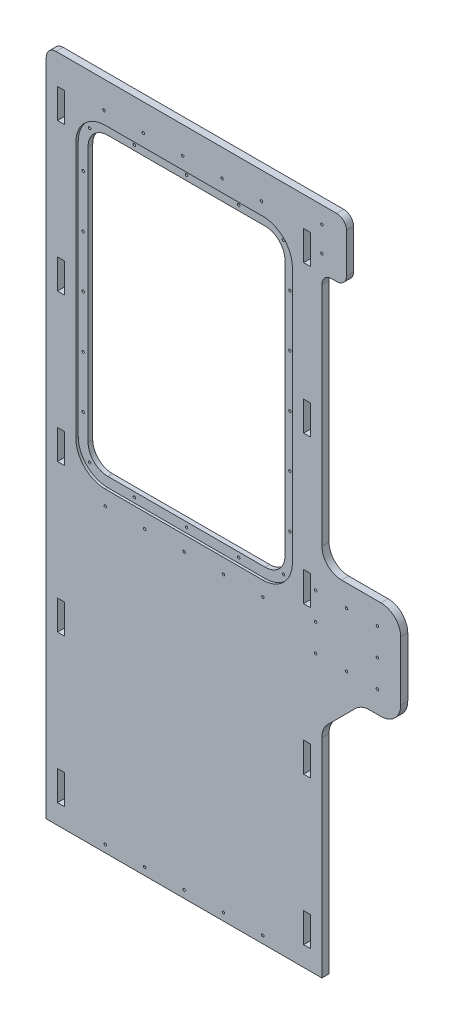
from build123d import *

# Parameters (mm, degrees)
BOSS_EXTRUDE1_DEPTH     = 18.288
SKETCH1_W               = 18.288
SKETCH1_H               = 76.2
MORTISE_CUTS_DEPTH      = 1955.524073472
LPATTERN1_COUNT         = 5
LPATTERN1_PITCH         = 381
WINDOW_RECESS_DEPTH     = 6.35
SKETCH3_R               = 3.175
CUT_EXTRUDE4_DEPTH      = 1955.474972641
SKETCH6_R               = 3.175
CUT_EXTRUDE5_DEPTH      = 1955.474972641
LPATTERN2_COUNT         = 3
LPATTERN2_PITCH         = 134.62
LPATTERN2_COL_COUNT     = 3
LPATTERN2_COL_PITCH     = 134.62
MIRROR1_COPY_1_SKETCH_R = 3.175
MIRROR1_COPY_1_DEPTH    = 1955.474972641
MIRROR1_COPY_2_SKETCH_R = 3.175
MIRROR1_COPY_2_DEPTH    = 1955.474972641
MIRROR1_COPY_3_SKETCH_R = 3.175
MIRROR1_COPY_3_DEPTH    = 1955.474972641
MIRROR1_COPY_4_SKETCH_R = 3.175
MIRROR1_COPY_4_DEPTH    = 1955.474972641
SKETCH7_R               = 3.175
CUT_EXTRUDE6_DEPTH      = 1955.474972641
LPATTERN3_COUNT         = 2
LPATTERN3_PITCH         = 134.62
LPATTERN3_COL_COUNT     = 2
LPATTERN3_COL_PITCH     = 134.62
MIRROR2_COPY_1_SKETCH_R = 3.175
MIRROR2_COPY_1_DEPTH    = 1955.474972641
MIRROR2_COPY_2_SKETCH_R = 3.175
MIRROR2_COPY_2_DEPTH    = 1955.474972641
SKETCH8_R               = 3.175
CUT_EXTRUDE7_DEPTH      = 1955.524073472
SKETCH9_R               = 3.175
CUT_EXTRUDE8_DEPTH      = 1955.524073472
SKETCH10_R              = 3.175
CUT_EXTRUDE9_DEPTH      = 1955.524073472
SKETCH11_R              = 3.175
CUT_EXTRUDE10_DEPTH     = 1955.524073472


with BuildPart() as part:
    # Model → Boss-Extrude1 (new body)
    with BuildSketch(Plane.XY):
        with BuildLine():
            Line((797.921024484, 645.521024484), (726.078975516, 573.678975516))
            ThreePointArc((726.078975516, 573.678975516), (715.066919748, 557.198269396), (711.2, 537.757951031))
            Line((711.2, 537.757951031), (711.2, 0))
            Line((711.2, 0), (0, 0))
            Line((0, 0), (0, 1701.93973))
            ThreePointArc((0, 1701.93973), (7.439487758, 1719.900242242), (25.4, 1727.33973))
            Line((25.4, 1727.33973), (711.2, 1727.33973))
            Line((711.2, 1727.33973), (749.3, 1727.33973))
            ThreePointArc((749.3, 1727.33973), (767.260512242, 1719.900242242), (774.7, 1701.93973))
            Line((774.7, 1701.93973), (774.7, 1600.33973))
            ThreePointArc((774.7, 1600.33973), (767.260512242, 1582.379217758), (749.3, 1574.93973))
            Line((749.3, 1574.93973), (736.6, 1574.93973))
            ThreePointArc((736.6, 1574.93973), (718.639487758, 1567.500242242), (711.2, 1549.53973))
            Line((711.2, 1549.53973), (711.2, 965.2))
            ThreePointArc((711.2, 965.2), (726.078975516, 929.278975516), (762, 914.4))
            Line((762, 914.4), (863.6, 914.4))
            ThreePointArc((863.6, 914.4), (899.521024484, 899.521024484), (914.4, 863.6))
            Line((914.4, 863.6), (914.4, 711.2))
            ThreePointArc((914.4, 711.2), (899.521024484, 675.278975516), (863.6, 660.4))
            Line((863.6, 660.4), (833.842048969, 660.4))
            ThreePointArc((833.842048969, 660.4), (814.401730604, 656.533080252), (797.921024484, 645.521024484))
        make_face()
        with BuildLine():
            Line((558.8, 838.33973), (152.4, 838.33973))
            ThreePointArc((152.4, 838.33973), (116.478975516, 853.218705516), (101.6, 889.13973))
            Line((101.6, 889.13973), (101.6, 1549.53973))
            ThreePointArc((101.6, 1549.53973), (116.478975516, 1585.460754484), (152.4, 1600.33973))
            Line((152.4, 1600.33973), (558.8, 1600.33973))
            ThreePointArc((558.8, 1600.33973), (594.721024484, 1585.460754484), (609.6, 1549.53973))
            Line((609.6, 1549.53973), (609.6, 889.13973))
            ThreePointArc((609.6, 889.13973), (594.721024484, 853.218705516), (558.8, 838.33973))
        make_face(mode=Mode.SUBTRACT)
    extrude(amount=BOSS_EXTRUDE1_DEPTH)

    # Sketch1 → Mortise cuts (cut, through all)
    with BuildSketch(Plane.XY.offset(18.288)):
        with Locations((673.1, 88.9)):
            Rectangle(SKETCH1_W, SKETCH1_H)
        with Locations((38.1, 88.9)):
            Rectangle(SKETCH1_W, SKETCH1_H)
    mortise_cuts = extrude(amount=-MORTISE_CUTS_DEPTH, mode=Mode.SUBTRACT)

    # LPattern1: Mortise cuts ×5
    with Locations(*[(0, i * LPATTERN1_PITCH, 0) for i in range(1, LPATTERN1_COUNT)]):
        add(mortise_cuts, mode=Mode.SUBTRACT)

    # Sketch2 → Window Recess (cut)
    with BuildSketch(Plane.XY.offset(18.288)):
        with BuildLine():
            Line((635, 889.13973), (635, 1549.53973))
            ThreePointArc((635, 1549.53973), (612.681536726, 1603.421266726), (558.8, 1625.73973))
            Line((558.8, 1625.73973), (152.4, 1625.73973))
            ThreePointArc((152.4, 1625.73973), (98.518463274, 1603.421266726), (76.2, 1549.53973))
            Line((76.2, 1549.53973), (76.2, 889.13973))
            ThreePointArc((76.2, 889.13973), (98.518463274, 835.258193274), (152.4, 812.93973))
            Line((152.4, 812.93973), (558.8, 812.93973))
            ThreePointArc((558.8, 812.93973), (612.681536726, 835.258193274), (635, 889.13973))
        make_face()
    extrude(amount=-WINDOW_RECESS_DEPTH, mode=Mode.SUBTRACT)

    # Sketch3 → Cut-Extrude4 (cut, through all)
    with BuildSketch(Plane.XY.offset(11.938)):
        with Locations((105.582684355, 1592.867273145)):
            Circle(SKETCH3_R)
        with Locations((605.617315645, 1592.867273145)):
            Circle(SKETCH3_R)
        with Locations((605.617315645, 845.812186855)):
            Circle(SKETCH3_R)
        with Locations((105.582684355, 845.812186855)):
            Circle(SKETCH3_R)
    extrude(amount=-CUT_EXTRUDE4_DEPTH, mode=Mode.SUBTRACT)

    # Sketch6 → Cut-Extrude5 (cut, through all)
    with BuildSketch(Plane.XY.offset(11.938)):
        with Locations((88.9, 1219.33973)):
            Circle(SKETCH6_R)
    cut_extrude5 = extrude(amount=-CUT_EXTRUDE5_DEPTH, mode=Mode.SUBTRACT)

    # LPattern2: Cut-Extrude5 ×3
    with Locations(*[(0, -i * LPATTERN2_PITCH, 0) for i in range(1, LPATTERN2_COUNT)]):
        add(cut_extrude5, mode=Mode.SUBTRACT)

    # LPattern2 col: Cut-Extrude5 ×3
    with Locations(*[(0, i * LPATTERN2_COL_PITCH, 0) for i in range(1, LPATTERN2_COL_COUNT)]):
        add(cut_extrude5, mode=Mode.SUBTRACT)

    # Mirror1: Cut-Extrude5 across plane
    add(cut_extrude5.mirror(Plane.ZY.offset(-355.6)), mode=Mode.SUBTRACT)

    # Mirror1 copy 1 sketch → Mirror1 copy 1 (cut, through all)
    with BuildSketch(Plane(origin=(711.2, -134.62, 11.938), x_dir=(-1, 0, 0), z_dir=(0, 0, 1))):
        with Locations((88.9, -1219.33973)):
            Circle(MIRROR1_COPY_1_SKETCH_R)
    extrude(amount=-MIRROR1_COPY_1_DEPTH, mode=Mode.SUBTRACT)

    # Mirror1 copy 2 sketch → Mirror1 copy 2 (cut, through all)
    with BuildSketch(Plane(origin=(711.2, -269.24, 11.938), x_dir=(-1, 0, 0), z_dir=(0, 0, 1))):
        with Locations((88.9, -1219.33973)):
            Circle(MIRROR1_COPY_2_SKETCH_R)
    extrude(amount=-MIRROR1_COPY_2_DEPTH, mode=Mode.SUBTRACT)

    # Mirror1 copy 3 sketch → Mirror1 copy 3 (cut, through all)
    with BuildSketch(Plane(origin=(711.2, 134.62, 11.938), x_dir=(-1, 0, 0), z_dir=(0, 0, 1))):
        with Locations((88.9, -1219.33973)):
            Circle(MIRROR1_COPY_3_SKETCH_R)
    extrude(amount=-MIRROR1_COPY_3_DEPTH, mode=Mode.SUBTRACT)

    # Mirror1 copy 4 sketch → Mirror1 copy 4 (cut, through all)
    with BuildSketch(Plane(origin=(711.2, 269.24, 11.938), x_dir=(-1, 0, 0), z_dir=(0, 0, 1))):
        with Locations((88.9, -1219.33973)):
            Circle(MIRROR1_COPY_4_SKETCH_R)
    extrude(amount=-MIRROR1_COPY_4_DEPTH, mode=Mode.SUBTRACT)

    # Sketch7 → Cut-Extrude6 (cut, through all)
    with BuildSketch(Plane.XY.offset(11.938)):
        with Locations((355.6, 1613.03973)):
            Circle(SKETCH7_R)
    cut_extrude6 = extrude(amount=-CUT_EXTRUDE6_DEPTH, mode=Mode.SUBTRACT)

    # LPattern3: Cut-Extrude6 ×2
    with Locations(*[(i * LPATTERN3_PITCH, 0, 0) for i in range(1, LPATTERN3_COUNT)]):
        add(cut_extrude6, mode=Mode.SUBTRACT)

    # LPattern3 col: Cut-Extrude6 ×2
    with Locations(*[(-i * LPATTERN3_COL_PITCH, 0, 0) for i in range(1, LPATTERN3_COL_COUNT)]):
        add(cut_extrude6, mode=Mode.SUBTRACT)

    # Mirror2: Cut-Extrude6 across plane
    add(cut_extrude6.mirror(Plane(origin=(0, 1219.33973, 0), x_dir=(0, 0, 1), z_dir=(0, -1, 0))), mode=Mode.SUBTRACT)

    # Mirror2 copy 1 sketch → Mirror2 copy 1 (cut, through all)
    with BuildSketch(Plane(origin=(134.62, 2438.67946, 11.938), x_dir=(1, 0, 0), z_dir=(0, 0, 1))):
        with Locations((355.6, -1613.03973)):
            Circle(MIRROR2_COPY_1_SKETCH_R)
    extrude(amount=-MIRROR2_COPY_1_DEPTH, mode=Mode.SUBTRACT)

    # Mirror2 copy 2 sketch → Mirror2 copy 2 (cut, through all)
    with BuildSketch(Plane(origin=(-134.62, 2438.67946, 11.938), x_dir=(1, 0, 0), z_dir=(0, 0, 1))):
        with Locations((355.6, -1613.03973)):
            Circle(MIRROR2_COPY_2_SKETCH_R)
    extrude(amount=-MIRROR2_COPY_2_DEPTH, mode=Mode.SUBTRACT)

    # Sketch8 → Cut-Extrude7 (cut, through all)
    with BuildSketch(Plane.XY.offset(18.288)):
        with Locations((558.8, 774.7)):
            Circle(SKETCH8_R)
        with Locations((457.2, 774.7)):
            Circle(SKETCH8_R)
        with Locations((355.6, 774.7)):
            Circle(SKETCH8_R)
        with Locations((254, 774.7)):
            Circle(SKETCH8_R)
        with Locations((152.4, 774.7)):
            Circle(SKETCH8_R)
        with Locations((558.8, 19.05)):
            Circle(SKETCH8_R)
        with Locations((457.2, 19.05)):
            Circle(SKETCH8_R)
        with Locations((355.6, 19.05)):
            Circle(SKETCH8_R)
        with Locations((254, 19.05)):
            Circle(SKETCH8_R)
        with Locations((152.4, 19.05)):
            Circle(SKETCH8_R)
    extrude(amount=-CUT_EXTRUDE7_DEPTH, mode=Mode.SUBTRACT)

    # Sketch9 → Cut-Extrude8 (cut, through all)
    with BuildSketch(Plane(origin=(0, 0, 0), x_dir=(-1, 0, 0), z_dir=(0, 0, -1))):
        with Locations((-774.7, 858.012)):
            Circle(SKETCH9_R)
        with Locations((-854.456, 858.012)):
            Circle(SKETCH9_R)
        with Locations((-694.944, 858.012)):
            Circle(SKETCH9_R)
        with Locations((-694.944, 787.4)):
            Circle(SKETCH9_R)
        with Locations((-694.944, 716.788)):
            Circle(SKETCH9_R)
        with Locations((-774.7, 716.788)):
            Circle(SKETCH9_R)
        with Locations((-854.456, 716.788)):
            Circle(SKETCH9_R)
        with Locations((-854.456, 787.4)):
            Circle(SKETCH9_R)
    extrude(amount=-CUT_EXTRUDE8_DEPTH, mode=Mode.SUBTRACT)

    # Sketch10 → Cut-Extrude9 (cut, through all)
    with BuildSketch(Plane(origin=(0, 0, 0), x_dir=(-1, 0, 0), z_dir=(0, 0, -1))):
        with Locations((-555.244, 1657.48973)):
            Circle(SKETCH10_R)
        with Locations((-453.644, 1657.48973)):
            Circle(SKETCH10_R)
        with Locations((-352.044, 1657.48973)):
            Circle(SKETCH10_R)
        with Locations((-250.444, 1657.48973)):
            Circle(SKETCH10_R)
        with Locations((-148.844, 1657.48973)):
            Circle(SKETCH10_R)
    extrude(amount=-CUT_EXTRUDE9_DEPTH, mode=Mode.SUBTRACT)

    # Sketch11 → Cut-Extrude10 (cut, through all)
    with BuildSketch(Plane(origin=(0, 0, 0), x_dir=(-1, 0, 0), z_dir=(0, 0, -1))):
        with Locations((-711.2, 1683.548964167)):
            Circle(SKETCH11_R)
        with Locations((-711.2, 1618.524964167)):
            Circle(SKETCH11_R)
    extrude(amount=-CUT_EXTRUDE10_DEPTH, mode=Mode.SUBTRACT)


solid = part.part
